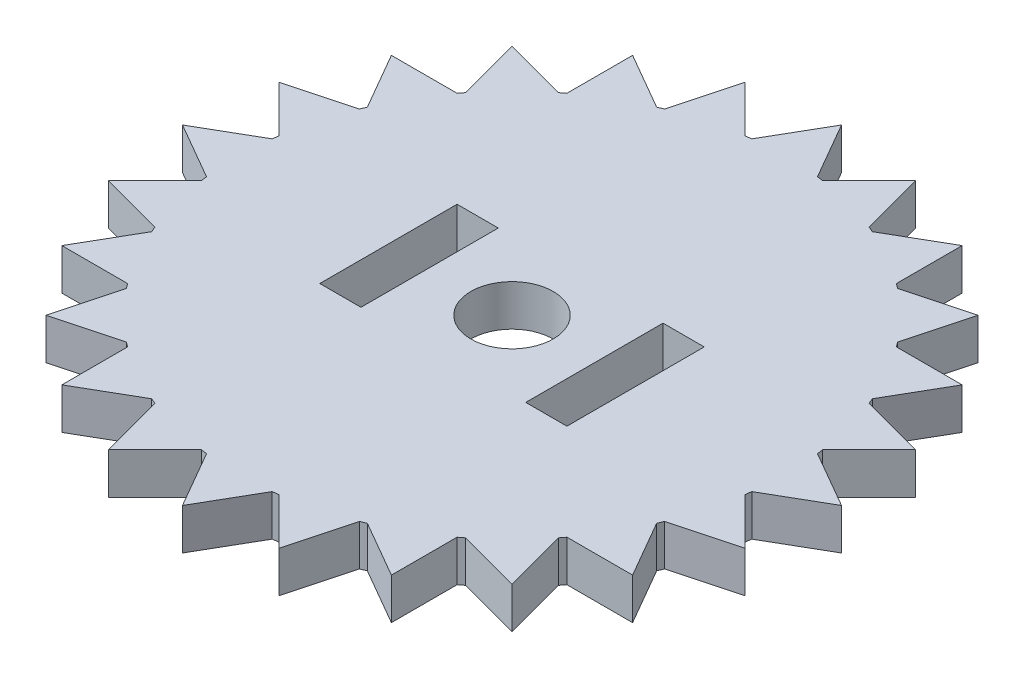
from build123d import *

# Parameters (mm, degrees)
SKETCH1_R           = 20
BOSS_EXTRUDE1_DEPTH = 3
BOSS_EXTRUDE2_DEPTH = 3
CIRPATTERN1_COUNT   = 24
SKETCH3_R           = 3
CUT_EXTRUDE1_DEPTH  = 3
SKETCH4_W           = 3
SKETCH4_H           = 10
CUT_EXTRUDE2_DEPTH  = 10


with BuildPart() as part:
    # Sketch1 → Boss-Extrude1 (new body)
    with BuildSketch(Plane(origin=(0, 0, 0), x_dir=(1, 0, 0), z_dir=(0, 1, 0))):
        with Locations(Location((0, 0, 0), (0, 0, 270))):
            Circle(SKETCH1_R)
    extrude(amount=BOSS_EXTRUDE1_DEPTH)

    # Sketch2 → Boss-Extrude2 (add)
    with BuildSketch(Plane(origin=(0, 3, 0), x_dir=(1, 0, 0), z_dir=(0, 1, 0))):
        Polygon((0, 24), (-2.392304845, 19.856406461), (2.392304845, 19.856406461), align=None)
    boss_extrude2 = extrude(amount=-BOSS_EXTRUDE2_DEPTH)

    # CirPattern1: Boss-Extrude2 ×24 about axis
    cirpattern1_axis = Axis((0, 0, 0), (0, 1, 0))
    for i in range(1, CIRPATTERN1_COUNT):
        add(boss_extrude2.rotate(cirpattern1_axis, i * 360 / CIRPATTERN1_COUNT))

    # Sketch3 → Cut-Extrude1 (cut)
    with BuildSketch(Plane(origin=(0, 3, 0), x_dir=(1, 0, 0), z_dir=(0, 1, 0))):
        with Locations(Location((0, 0, 0), (0, 0, 270))):
            Circle(SKETCH3_R)
    extrude(amount=-CUT_EXTRUDE1_DEPTH, mode=Mode.SUBTRACT)

    # Sketch4 → Cut-Extrude2 (cut)
    with BuildSketch(Plane(origin=(0, 3, 0), x_dir=(1, 0, 0), z_dir=(0, 1, 0))):
        with Locations((-7.5, 0)):
            Rectangle(SKETCH4_W, SKETCH4_H)
        with Locations((7.5, 0)):
            Rectangle(SKETCH4_W, SKETCH4_H)
    extrude(amount=-CUT_EXTRUDE2_DEPTH, mode=Mode.SUBTRACT)


solid = part.part
